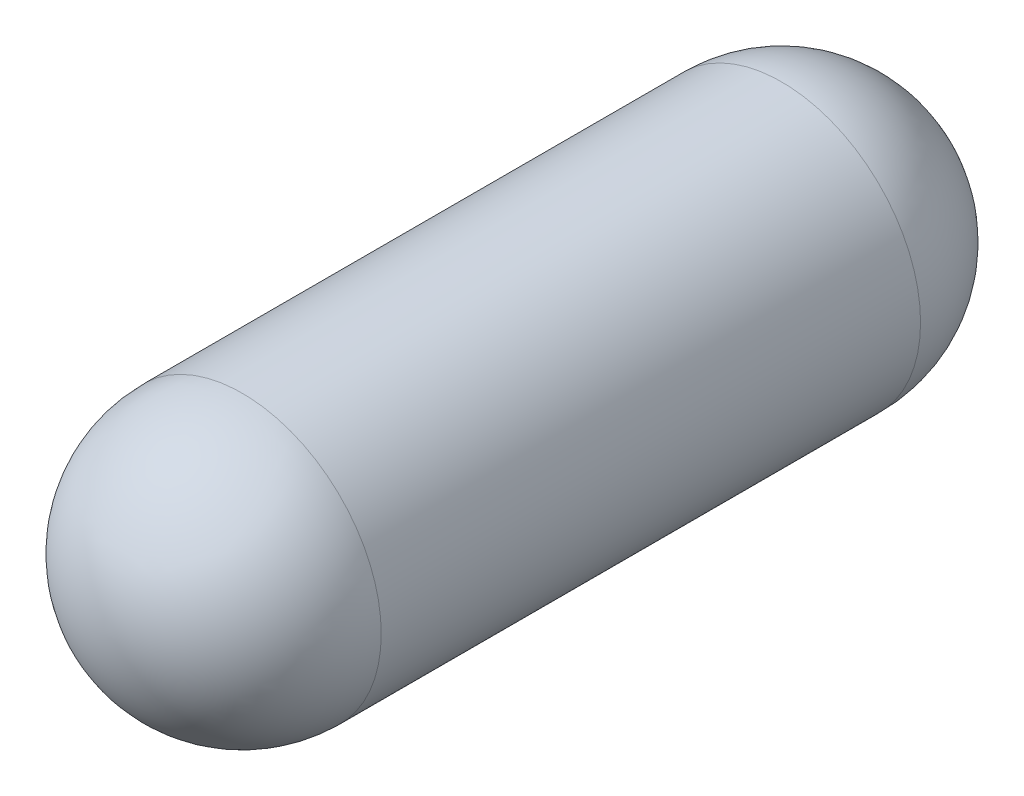
from build123d import *

# Parameters (mm, degrees)
BOSS_EXTRUDE1_DEPTH      = 25
BOSS_EXTRUDE1_DEPTH_BACK = 25
SKETCH2_R                = 8.5
FILLET1_R                = 8.5


with BuildPart() as part:
    # Sketch2 → Boss-Extrude1 (new, two sides: drawn at the far end of the back side and taken through both)
    with BuildSketch(Plane.XY.offset(-BOSS_EXTRUDE1_DEPTH_BACK)):
        Circle(SKETCH2_R)
    extrude(amount=BOSS_EXTRUDE1_DEPTH + BOSS_EXTRUDE1_DEPTH_BACK)

    # Fillet1
    fillet1_edges = [part.edges().sort_by_distance(p)[0] for p in [
        (-8.5, 0, -25),
        (-8.5, 0, 25),
    ]]
    fillet(fillet1_edges, radius=FILLET1_R)


solid = part.part
